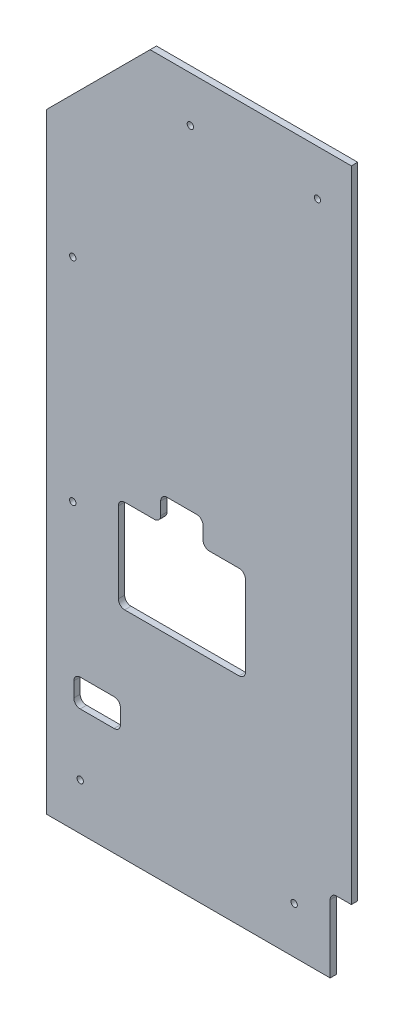
from build123d import *

# Parameters (mm, degrees)
ESQUISSE1_W                  = 144
ESQUISSE1_H                  = 337
BOSS_EXTRU_1_DEPTH           = 3
ESQUISSE2_R                  = 1.5
ENL_V_MAT_EXTRU_1_DEPTH      = 367.488744711
CHANFREIN1_SIZE              = 49
ENL_V_MAT_EXTRU_2_DEPTH      = 367.488744711
ENL_V_MAT_EXTRU_2_DEPTH_BACK = 367.488744711
ESQUISSE3_W                  = 10
ESQUISSE3_H                  = 35
ESQUISSE4_W                  = 22
ESQUISSE4_H                  = 13
ENL_V_MAT_EXTRU_3_DEPTH      = 367.488744711
ENL_V_MAT_EXTRU_4_DEPTH      = 367.488744711
ENL_V_MAT_EXTRU_7_DEPTH      = 367.488744711
BOSS_EXTRU_3_DEPTH           = 3
CONG_4_R                     = 3


with BuildPart() as part:
    # Esquisse1 → Boss.-Extru.1 (new body)
    with BuildSketch(Plane.XY):
        with Locations((72, 168.5)):
            Rectangle(ESQUISSE1_W, ESQUISSE1_H)
    extrude(amount=BOSS_EXTRU_1_DEPTH)

    # Esquisse2 → Enlèv. mat.-Extru.1 (cut, through all)
    with BuildSketch(Plane.XY.offset(3)):
        with Locations((16, 22)):
            Circle(ESQUISSE2_R)
        with Locations((12.5, 234)):
            Circle(ESQUISSE2_R)
        with Locations((12.5, 134)):
            Circle(ESQUISSE2_R)
        with Locations((68, 315.5)):
            Circle(ESQUISSE2_R)
        with Locations((128, 315.5)):
            Circle(ESQUISSE2_R)
        with Locations((117, 22)):
            Circle(ESQUISSE2_R)
    extrude(amount=-ENL_V_MAT_EXTRU_1_DEPTH, mode=Mode.SUBTRACT)

    # Chanfrein1
    chanfrein1_edges = [part.edges().sort_by_distance(p)[0] for p in [
        (0, 337, 1.5),
    ]]
    chamfer(chanfrein1_edges, length=CHANFREIN1_SIZE)

    # Esquisse3 → Enlèv. mat.-Extru.2 (cut, two sides: drawn at the far end of the back side and taken through both)
    with BuildSketch(Plane.XY.offset(3).offset(-ENL_V_MAT_EXTRU_2_DEPTH_BACK)):
        with Locations((139, 17.5)):
            Rectangle(ESQUISSE3_W, ESQUISSE3_H)
    extrude(amount=ENL_V_MAT_EXTRU_2_DEPTH + ENL_V_MAT_EXTRU_2_DEPTH_BACK, mode=Mode.SUBTRACT)

    # Esquisse4 → Enlèv. mat.-Extru.3 (cut, through all)
    with BuildSketch(Plane.XY.offset(3)):
        with Locations((24, 57.5)):
            Rectangle(ESQUISSE4_W, ESQUISSE4_H)
    extrude(amount=-ENL_V_MAT_EXTRU_3_DEPTH, mode=Mode.SUBTRACT)

    # Esquisse5 → Enlèv. mat.-Extru.4 (cut, through all)
    with BuildSketch(Plane.XY.offset(3)):
        with BuildLine():
            Line((144, 60), (90, 60))
            Line((90, 60), (90, 190))
            ThreePointArc((90, 190), (68.473980144, 267.875312279), (144, 296.576429297))
            Line((144, 296.576429297), (144, 60))
        make_face()
    extrude(amount=-ENL_V_MAT_EXTRU_4_DEPTH, mode=Mode.SUBTRACT)

    # Esquisse9 → Enlèv. mat.-Extru.7 (cut, through all)
    with BuildSketch(Plane.XY.offset(3)):
        Polygon((94, 102), (34, 102), (34, 146), (54, 146), (54, 158), (74, 158), (74, 146), (94, 146), align=None)
    extrude(amount=-ENL_V_MAT_EXTRU_7_DEPTH, mode=Mode.SUBTRACT)

    # Esquisse10 → Boss.-Extru.3 (add)
    with BuildSketch(Plane.XY.offset(3)):
        Polygon((144, 60), (90, 60), (90, 102), (94, 102), (94, 146), (90, 146), (90, 190), (55, 190), (55, 302), (144, 302), align=None)
    extrude(amount=-BOSS_EXTRU_3_DEPTH)

    # Congé4
    cong_4_edges = [part.edges().sort_by_distance(p)[0] for p in [
        (74, 146, 1.5),
        (34, 102, 1.5),
        (34, 146, 1.5),
        (54, 146, 1.5),
        (54, 158, 1.5),
        (74, 158, 1.5),
        (94, 102, 1.5),
        (94, 146, 1.5),
        (134, 35, 1.5),
        (13, 51, 1.5),
        (13, 64, 1.5),
        (35, 64, 1.5),
        (35, 51, 1.5),
    ]]
    fillet(cong_4_edges, radius=CONG_4_R)


solid = part.part
